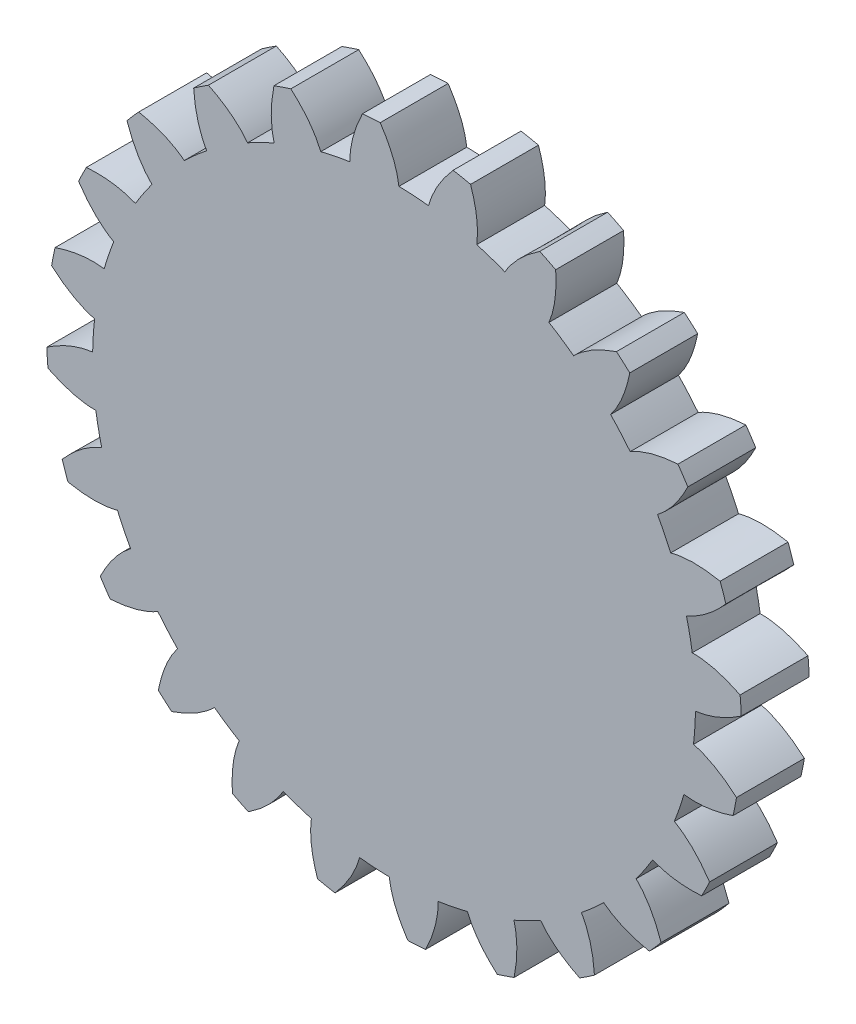
from build123d import *

# Parameters (mm, degrees)
SKETCH7_R           = 11.276311449
BOSS_EXTRUDE3_DEPTH = 2.54
BOSS_EXTRUDE4_DEPTH = 2.54
CIRPATTERN2_COUNT   = 24


with BuildPart() as part:
    # Sketch7 → Boss-Extrude3 (new body)
    with BuildSketch(Plane.XY):
        Circle(SKETCH7_R)
    extrude(amount=BOSS_EXTRUDE3_DEPTH)

    # Sketch6 → Boss-Extrude4 (add)
    with BuildSketch(Plane.XY):
        with BuildLine():
            ThreePointArc((-0.517989423, 12.989676168), (-0.85024068, 12.972166002), (-1.181935017, 12.946158875))
            add(Edge.make_bspline(
                [(-1.651695483, 11.154689684), (-1.655611794, 11.769584865), (-1.461717739, 12.377817835), (-1.181935017, 12.946158875)],
                knots=[0, 0, 0, 0, 0.501254588, 0.501254588, 0.501254588, 0.501254588], degree=3))
            ThreePointArc((-1.651695483, 11.154689684), (-0.737506055, 11.252168001), (0.181585829, 11.274849289))
            add(Edge.make_bspline(
                [(0.181585829, 11.274849289), (0.105208709, 11.884995138), (-0.166416888, 12.462716338), (-0.517989423, 12.989676168)],
                knots=[0, 0, 0, 0, 0.501254588, 0.501254588, 0.501254588, 0.501254588], degree=3))
        make_face()
    boss_extrude4 = extrude(amount=BOSS_EXTRUDE4_DEPTH)

    # CirPattern2: Boss-Extrude4 ×24 about axis
    cirpattern2_axis = Axis((0, 0, 2.54), (0, 0, 1))
    for i in range(1, CIRPATTERN2_COUNT):
        add(boss_extrude4.rotate(cirpattern2_axis, i * 360 / CIRPATTERN2_COUNT))


solid = part.part
